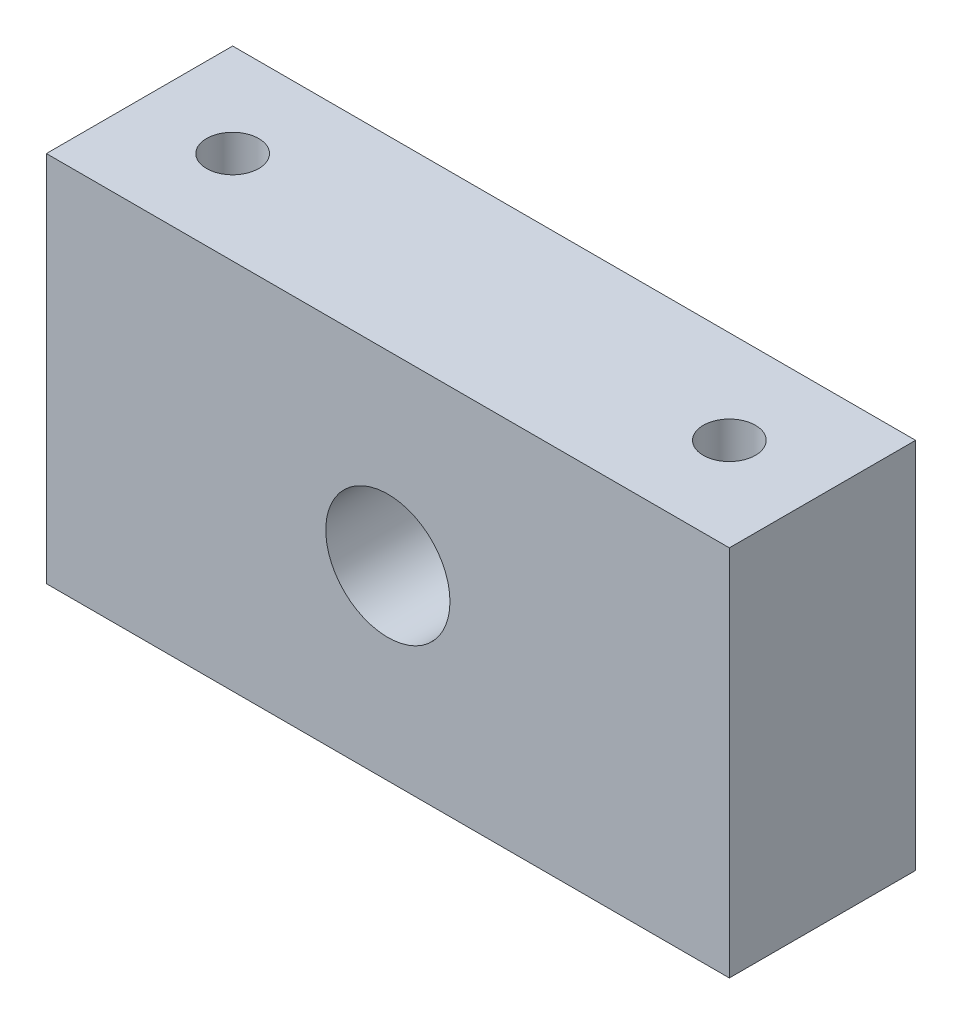
from build123d import *

# Parameters (mm, degrees)
SKETCH1_W             = 55
SKETCH1_H             = 15
BOSS_EXTRUDE1_DEPTH   = 15
SKETCH3_R             = 5
CUT_EXTRUDE1_DEPTH    = 35.731109974
M5_TAPPED_HOLE1_D     = 4.2
M5_TAPPED_HOLE1_DEPTH = 20
M5_TAPPED_HOLE1_TIP   = 1.2618073


with BuildPart() as part:
    # Sketch1 → Boss-Extrude1 (new, symmetric)
    with BuildSketch(Plane(origin=(0, 0, 0), x_dir=(1, 0, 0), z_dir=(0, 1, 0))):
        Rectangle(SKETCH1_W, SKETCH1_H)
    extrude(amount=BOSS_EXTRUDE1_DEPTH, both=True)

    # Sketch3 → Cut-Extrude1 (cut, through all)
    with BuildSketch(Plane.XY.offset(7.5)):
        Circle(SKETCH3_R)
    extrude(amount=-CUT_EXTRUDE1_DEPTH, mode=Mode.SUBTRACT)

    # M5 Tapped Hole1
    with Locations(Plane(origin=(0, 15, 0), x_dir=(1, 0, 0), z_dir=(0, 1, 0))):
        with Locations((-20, 0), (20, 0)):
            Hole(M5_TAPPED_HOLE1_D / 2, depth=M5_TAPPED_HOLE1_DEPTH)
            with Locations((0, 0, -(M5_TAPPED_HOLE1_DEPTH + M5_TAPPED_HOLE1_TIP / 2))):  # 118° drill point
                Cone(0, M5_TAPPED_HOLE1_D / 2, M5_TAPPED_HOLE1_TIP, mode=Mode.SUBTRACT)


solid = part.part
